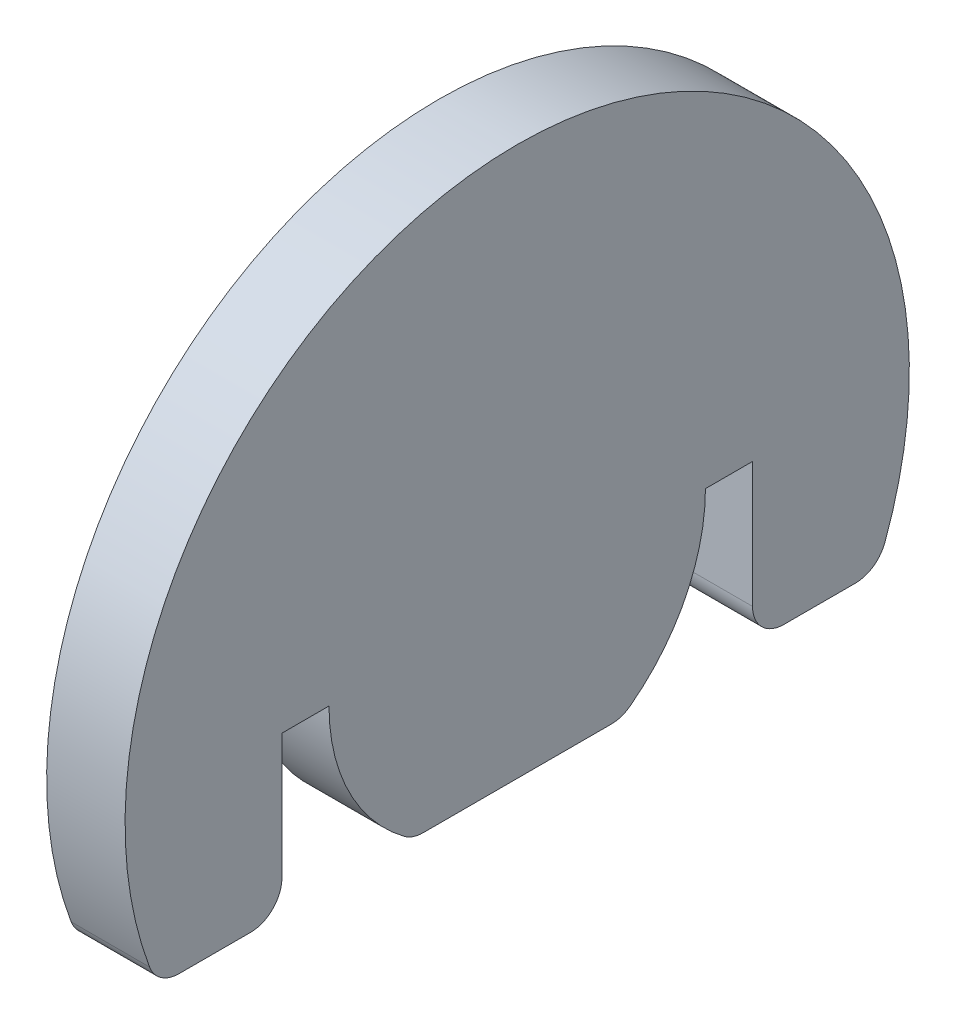
from build123d import *

# Parameters (mm, degrees)
BOSS_EXTRUDE1_DEPTH = 1.25
FILLET1_R           = 1


with BuildPart() as part:
    # Sketch1 → Boss-Extrude1 (new, symmetric)
    with BuildSketch(Plane(origin=(0, 0, 0), x_dir=(0, 0, -1), z_dir=(1, 0, 0))):
        with BuildLine():
            Line((7.5, -5), (11.456439237, -5))
            ThreePointArc((11.456439237, -5), (12.5, 0), (11.456439237, 5))
            Line((11.456439237, 5), (-11.456439237, 5))
            ThreePointArc((-11.456439237, 5), (-12.5, 0), (-11.456439237, -5))
            Line((-11.456439237, -5), (-7.5, -5))
            Line((-7.5, -5), (-7.5, 0))
            Line((-7.5, 0), (-6, 0))
            ThreePointArc((-6, 0), (-5.286764074, -2.837274331), (-3.31662479, -5))
            Line((-3.31662479, -5), (-4.153311931, -5))
            Line((-4.153311931, -5), (3.31662479, -5))
            ThreePointArc((3.31662479, -5), (5.286764074, -2.837274331), (6, 0))
            Line((6, 0), (7.5, 0))
            Line((7.5, 0), (7.5, -5))
        make_face()
        with BuildLine():
            ThreePointArc((11.456439237, 5), (0, 12.5), (-11.456439237, 5))
            Line((-11.456439237, 5), (11.456439237, 5))
        make_face()
    extrude(amount=BOSS_EXTRUDE1_DEPTH, both=True)

    # Fillet1
    fillet1_edges = [part.edges().sort_by_distance(p)[0] for p in [
        (0, -5, -3.31662479),
        (0, -5, 3.31662479),
        (0, -5, 7.5),
        (0, -5, 11.456439237),
        (0, -5, -11.456439237),
        (0, -5, -7.5),
    ]]
    fillet(fillet1_edges, radius=FILLET1_R)


solid = part.part
